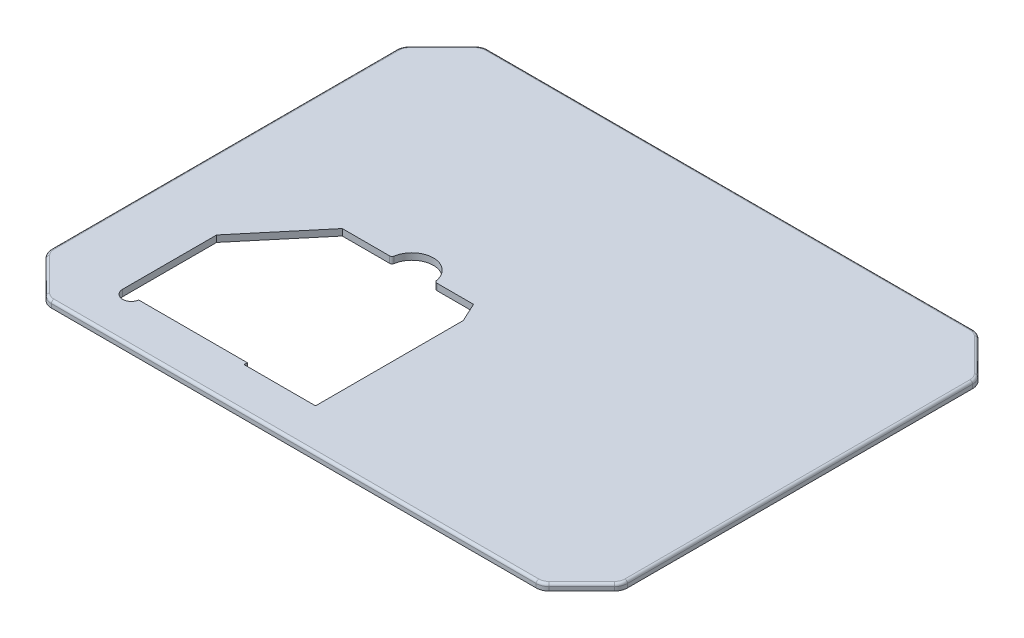
from build123d import *

# Parameters (mm, degrees)
BOSS_EXTRUDE1_DEPTH = 2.5
FILLET2_R           = 5
FILLET3_R           = 1


with BuildPart() as part:
    # Sketch1 → Boss-Extrude1 (new body)
    with BuildSketch(Plane(origin=(0, 0, 0), x_dir=(1, 0, 0), z_dir=(0, 1, 0))):
        Polygon((137.875, 109.125), (-52.875, 109.125), (-68.375, 93.625), (-68.375, -43.375), (-52.875, -58.875), (137.875, -58.875), (153.375, -43.375), (153.375, 93.625), align=None)
        with BuildLine():
            Line((-40.875, -5.193242225), (-18.827366795, 21.125))
            Line((-18.827366795, 21.125), (0.240165454, 21.125))
            ThreePointArc((0.240165454, 21.125), (8.475, 28.875), (16.709834546, 21.125))
            Line((16.709834546, 21.125), (31.683656114, 21.125))
            Line((31.683656114, 21.125), (35.125, 13.735720962))
            Line((35.125, 13.735720962), (35.125, -43.125))
            Line((35.125, -43.125), (7.625, -43.125))
            Line((7.625, -43.125), (7.625, -41.875))
            Line((7.625, -41.875), (-34.162242519, -41.875))
            ThreePointArc((-34.162242519, -41.875), (-37.750692543, -44.740676492), (-40.875, -41.375))
            Line((-40.875, -41.375), (-40.875, -5.193242225))
        make_face(mode=Mode.SUBTRACT)
    extrude(amount=BOSS_EXTRUDE1_DEPTH)

    # Fillet2
    fillet2_edges = [part.edges().sort_by_distance(p)[0] for p in [
        (-68.375, 1.25, 43.375),
        (-68.375, 1.25, -93.625),
        (-52.875, 1.25, -109.125),
        (137.875, 1.25, -109.125),
        (153.375, 1.25, -93.625),
        (153.375, 1.25, 43.375),
        (137.875, 1.25, 58.875),
        (-52.875, 1.25, 58.875),
    ]]
    fillet(fillet2_edges, radius=FILLET2_R)

    # Fillet3
    fillet3_edges = [part.edges().sort_by_distance(p)[0] for p in [
        (16.709834546, 1.25, -21.125),
        (0.240165454, 1.25, -21.125),
        (-68.375, 2.5, -25.125),
        (-60.625, 2.5, -101.375),
        (-60.625, 2.5, 51.125),
        (42.5, 2.5, 58.875),
        (145.625, 2.5, 51.125),
        (153.375, 2.5, -25.125),
        (145.625, 2.5, -101.375),
        (42.5, 2.5, -109.125),
        (-67.994397663, 2.5, 43.21734935),
        (-52.71734935, 2.5, 58.494397663),
        (137.71734935, 2.5, 58.494397663),
        (152.994397663, 2.5, 43.21734935),
        (137.71734935, 2.5, -108.744397663),
        (152.994397663, 2.5, -93.46734935),
        (-52.71734935, 2.5, -108.744397663),
        (-67.994397663, 2.5, -93.46734935),
    ]]
    fillet(fillet3_edges, radius=FILLET3_R)


solid = part.part
